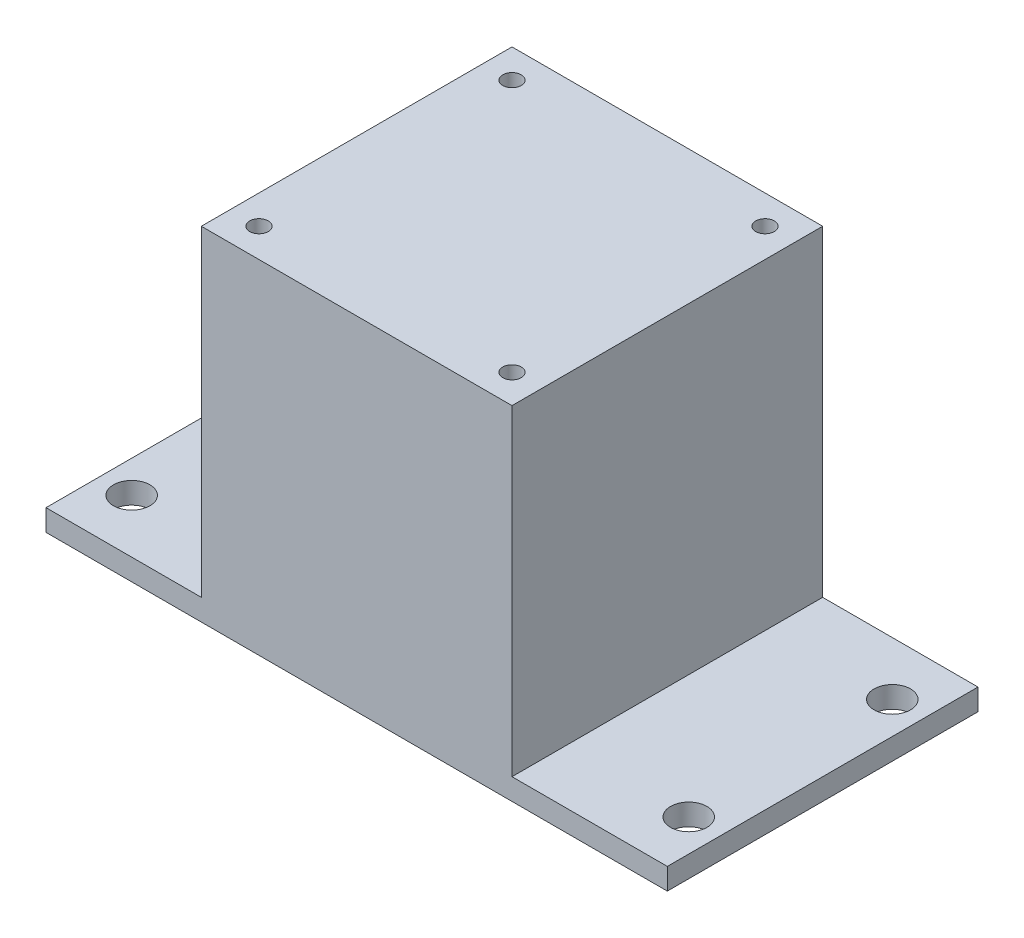
from build123d import *

# Parameters (mm, degrees)
SKETCH1_W           = 73.66
SKETCH1_H           = 36.83
SKETCH1_R           = 1.0999978
SKETCH1_R_2         = 2.159
BOSS_EXTRUDE1_DEPTH = 40.64
SKETCH3_R           = 2.54
CUT_EXTRUDE2_DEPTH  = 38.1
SKETCH4_W           = 18.415
SKETCH4_H           = 36.83
CUT_EXTRUDE3_DEPTH  = 38.1


with BuildPart() as part:
    # Sketch1 → Boss-Extrude1 (new body)
    with BuildSketch(Plane(origin=(0, 0, 0), x_dir=(1, 0, 0), z_dir=(0, 1, 0))):
        with Locations((-1.422532637, -3.27613577)):
            Rectangle(SKETCH1_W, SKETCH1_H)
        with Locations(Location((-16.422528037, 11.72385963, 0), (0, 0, 270))):
            Circle(SKETCH1_R, mode=Mode.SUBTRACT)
        with Locations(Location((13.577462763, 11.72385963, 0), (0, 0, 90))):
            Circle(SKETCH1_R, mode=Mode.SUBTRACT)
        with Locations(Location((13.577462763, -18.27613117, 0), (0, 0, 270))):
            Circle(SKETCH1_R, mode=Mode.SUBTRACT)
        with Locations(Location((-16.422528037, -18.27613117, 0), (0, 0, 90))):
            Circle(SKETCH1_R, mode=Mode.SUBTRACT)
        with Locations(Location((31.597467363, -15.34113577, 0), (0, 0, 270))):
            Circle(SKETCH1_R_2, mode=Mode.SUBTRACT)
        with Locations(Location((31.597467363, 8.78886423, 0), (0, 0, 90))):
            Circle(SKETCH1_R_2, mode=Mode.SUBTRACT)
        with Locations(Location((-34.442532637, -15.34113577, 0), (0, 0, 90))):
            Circle(SKETCH1_R_2, mode=Mode.SUBTRACT)
        with Locations(Location((-34.442532637, 8.78886423, 0), (0, 0, 270))):
            Circle(SKETCH1_R_2, mode=Mode.SUBTRACT)
    extrude(amount=BOSS_EXTRUDE1_DEPTH)

    # Sketch3 → Cut-Extrude2 (cut)
    with BuildSketch(Plane.XZ):
        with Locations(Location((-16.422528037, 18.27613117, 0), (0, 0, 270))):
            Circle(SKETCH3_R)
        with Locations(Location((13.577462763, 18.27613117, 0), (0, 0, 270))):
            Circle(SKETCH3_R)
        with Locations(Location((13.577462763, -11.72385963, 0), (0, 0, 270))):
            Circle(SKETCH3_R)
        with Locations(Location((-16.422528037, -11.72385963, 0), (0, 0, 270))):
            Circle(SKETCH3_R)
    extrude(amount=-CUT_EXTRUDE2_DEPTH, mode=Mode.SUBTRACT)

    # Sketch4 → Cut-Extrude3 (cut)
    with BuildSketch(Plane(origin=(0, 40.64, 0), x_dir=(1, 0, 0), z_dir=(0, 1, 0))):
        with Locations((-29.045032637, -3.27613577)):
            Rectangle(SKETCH4_W, SKETCH4_H)
        with Locations((26.199967363, -3.27613577)):
            Rectangle(SKETCH4_W, SKETCH4_H)
    extrude(amount=-CUT_EXTRUDE3_DEPTH, mode=Mode.SUBTRACT)


solid = part.part
